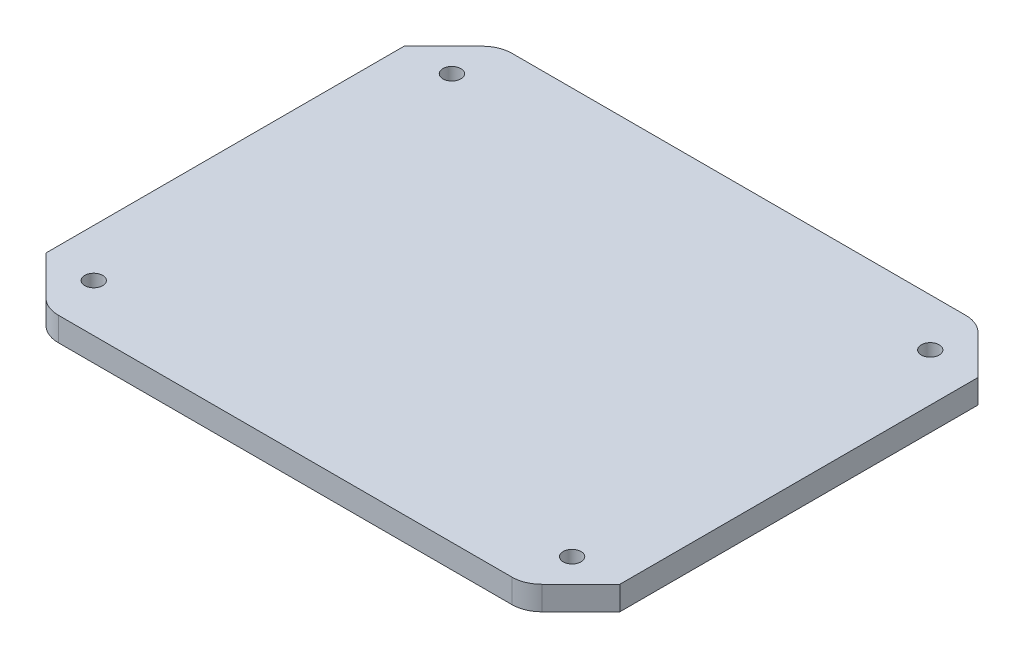
from build123d import *

# Parameters (mm, degrees)
SKETCH1_R           = 1.5
BOSS_EXTRUDE1_DEPTH = 4


with BuildPart() as part:
    # Sketch1 → Boss-Extrude1 (new body)
    with BuildSketch(Plane(origin=(0, 0, 0), x_dir=(1, 0, 0), z_dir=(0, 1, 0))):
        with BuildLine():
            Line((-40.245236531, 36.750583468), (-46.780770437, 30.215049562))
            Line((-46.780770437, 30.215049562), (-46.780770437, -29.784950438))
            Line((-46.780770437, -29.784950438), (-40.245236531, -36.320484344))
            ThreePointArc((-40.245236531, -36.320484344), (-38.623119787, -37.4043481), (-36.709702625, -37.784950438))
            Line((-36.709702625, -37.784950438), (39.290297375, -37.784950438))
            ThreePointArc((39.290297375, -37.784950438), (41.203714536, -37.4043481), (42.82583128, -36.320484344))
            Line((42.82583128, -36.320484344), (49.361365186, -29.784950438))
            Line((49.361365186, -29.784950438), (49.361365186, 30.215049562))
            Line((49.361365186, 30.215049562), (42.82583128, 36.750583468))
            ThreePointArc((42.82583128, 36.750583468), (41.203714536, 37.834447225), (39.290297375, 38.215049562))
            Line((39.290297375, 38.215049562), (-36.709702625, 38.215049562))
            ThreePointArc((-36.709702625, 38.215049562), (-38.623119787, 37.834447225), (-40.245236531, 36.750583468))
        make_face()
        with Locations(Location((41.361365186, -29.784950438, 0), (0, 0, 270))):
            Circle(SKETCH1_R, mode=Mode.SUBTRACT)
        with Locations(Location((41.361365186, 30.215049562, 0), (0, 0, 270))):
            Circle(SKETCH1_R, mode=Mode.SUBTRACT)
        with Locations(Location((-38.780770437, -29.784950438, 0), (0, 0, 270))):
            Circle(SKETCH1_R, mode=Mode.SUBTRACT)
        with Locations(Location((-38.780770437, 30.215049562, 0), (0, 0, 270))):
            Circle(SKETCH1_R, mode=Mode.SUBTRACT)
    extrude(amount=BOSS_EXTRUDE1_DEPTH)


solid = part.part
